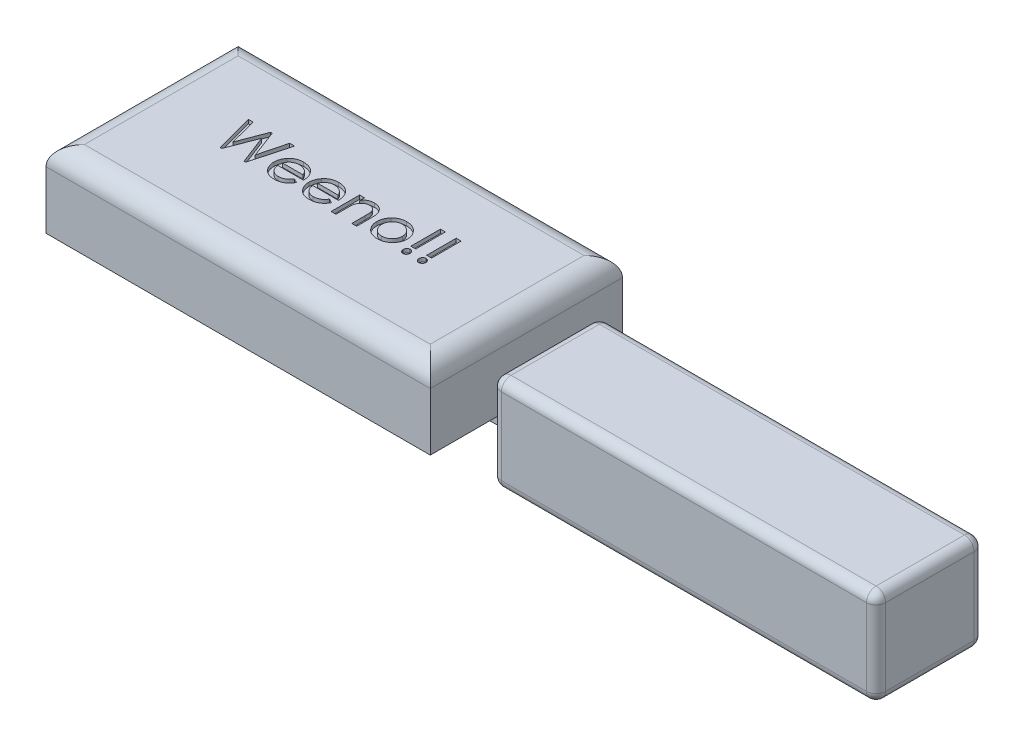
from build123d import *

# Parameters (mm, degrees)
BOSS_EXTRUDE1_DEPTH      = 20
BOSS_EXTRUDE2_DEPTH      = 1
BOSS_EXTRUDE2_DEPTH_BACK = 3.5
SKETCH1_3_W              = 5
SKETCH1_3_H              = 12
BOSS_EXTRUDE3_DEPTH      = 15
BOSS_EXTRUDE3_DEPTH_BACK = 10
SKETCH2_W                = 12
SKETCH2_H                = 3.5
BOSS_EXTRUDE4_DEPTH      = 4.5
FILLET1_R                = 2.5
SKETCH3_W                = 1.282051282
SKETCH3_H                = 7.692307692
CUT_EXTRUDE1_DEPTH       = 1
FILLET2_R                = 5


with BuildPart() as part:
    # Sketch1 → Boss-Extrude1 (new body)
    with BuildSketch(Plane(origin=(0, 0, 0), x_dir=(1, 0, 0), z_dir=(0, 1, 0))):
        Polygon((50, 25), (-50, 25), (-50, -25), (50, -25), (50, -6), (50, 6), align=None)
    extrude(amount=BOSS_EXTRUDE1_DEPTH)

    # Sketch1<3> → Boss-Extrude2 (add, two sides: drawn at the far end of the back side and taken through both)
    with BuildSketch(Plane(origin=(0, 0, 0), x_dir=(1, 0, 0), z_dir=(0, 1, 0)).offset(-BOSS_EXTRUDE2_DEPTH_BACK)):
        with Locations((52.5, 0)):
            Rectangle(SKETCH1_3_W, SKETCH1_3_H)
    extrude(amount=BOSS_EXTRUDE2_DEPTH + BOSS_EXTRUDE2_DEPTH_BACK)

    # Sketch1<4> → Boss-Extrude3 (add, two sides: drawn at the far end of the back side and taken through both)
    with BuildSketch(Plane(origin=(0, 0, 0), x_dir=(1, 0, 0), z_dir=(0, 1, 0)).offset(-BOSS_EXTRUDE3_DEPTH_BACK)):
        Polygon((55, 14), (55, 6), (55, -6), (55, -14), (155, -14), (155, 14), align=None)
    extrude(amount=BOSS_EXTRUDE3_DEPTH + BOSS_EXTRUDE3_DEPTH_BACK)

    # Sketch2 → Boss-Extrude4 (add)
    with BuildSketch(Plane.ZY.offset(-50)):
        with Locations((0, -1.75)):
            Rectangle(SKETCH2_W, SKETCH2_H)
    extrude(amount=BOSS_EXTRUDE4_DEPTH)

    # Fillet1
    fillet1_edges = [part.edges().sort_by_distance(p)[0] for p in [
        (55, 2.5, -14),
        (105, -10, -14),
        (55, -10, 0),
        (105, -10, 14),
        (55, 2.5, 14),
        (105, 15, 14),
        (55, 15, 0),
        (105, 15, -14),
        (155, -10, 0),
        (155, 2.5, 14),
        (155, 15, 0),
        (155, 2.5, -14),
    ]]
    fillet(fillet1_edges, radius=FILLET1_R)

    # Sketch3 → Cut-Extrude1 (cut)
    # profile 1 of 9: a face of its own
    with BuildSketch(Plane(origin=(0, 20, 0), x_dir=(1, 0, 0), z_dir=(0, 1, 0))):
        Polygon((-29.358974359, 7), (-28.084935897, 7), (-26.252003205, -0.145432692), (-23.537660256, 7), (-23.118990385, 7), (-20.424679487, -0.131410256), (-18.581730769, 7), (-17.307692308, 7), (-20.028044872, -3), (-20.46474359, -3), (-23.339342949, 4.455929487), (-26.231971154, -3), (-26.664663462, -3), align=None)
    # profile 2 of 9: a face of its own
    with BuildSketch(Plane(origin=(0, 20, 0), x_dir=(1, 0, 0), z_dir=(0, 1, 0))):
        with BuildLine():
            Line((-9.913862179, -0.435897436), (-8.846153846, -0.946714744))
            add(Edge.make_bspline(
                [(-8.846153846, -0.946714744), (-8.913655595, -1.069390674), (-9.045109243, -1.308291132), (-9.269417602, -1.638185295), (-9.512848911, -1.928308753), (-9.773037091, -2.181872441), (-10.053228209, -2.398816509), (-10.348379214, -2.591281744), (-10.664750233, -2.752662842), (-10.998280777, -2.890606062), (-11.353349041, -2.996758493), (-11.729517882, -3.072170711), (-12.127555992, -3.119147338), (-12.400374831, -3.125137852), (-12.540064103, -3.128205128)],
                knots=[0, 0, 0, 0, 1.110387997, 2.162381809, 3.158716456, 4.110235088, 5.03849693, 5.965639636, 6.901458115, 7.851707839, 8.825366416, 9.836184406, 10.892078622, 12, 12, 12, 12], degree=3))
            add(Edge.make_bspline(
                [(-12.540064103, -3.128205128), (-12.68783843, -3.125160716), (-12.97649493, -3.119213881), (-13.396070788, -3.060758307), (-13.791979671, -2.972299885), (-14.162787395, -2.844184271), (-14.507062703, -2.67591731), (-14.828913616, -2.475001954), (-15.124557524, -2.235193815), (-15.391171189, -1.960531122), (-15.628004547, -1.663892068), (-15.839671212, -1.35696325), (-16.012799111, -1.036665247), (-16.159023103, -0.70918015), (-16.271581613, -0.370975934), (-16.35133028, -0.023535219), (-16.401410406, 0.333878202), (-16.407283096, 0.575556252), (-16.41025641, 0.697916667)],
                knots=[0, 0, 0, 0, 1.164566152, 2.274817246, 3.333639364, 4.359360714, 5.360157823, 6.349126428, 7.344925074, 8.35392925, 9.361228562, 10.335284257, 11.289572886, 12.22779236, 13.160187688, 14.095091993, 15.035554391, 16, 16, 16, 16], degree=3))
            add(Edge.make_bspline(
                [(-16.41025641, 0.697916667), (-16.407653095, 0.812238517), (-16.402489482, 1.038993122), (-16.358448793, 1.373876333), (-16.291311127, 1.69989056), (-16.194600808, 2.015702872), (-16.069437824, 2.321869113), (-15.916761288, 2.618815133), (-15.73646701, 2.9064579), (-15.597158087, 3.086838736), (-15.526842949, 3.177884615)],
                knots=[0, 0, 0, 0, 1.021096707, 2.025320431, 3.012923591, 3.992437812, 4.971861174, 5.964497656, 6.972595394, 8, 8, 8, 8], degree=3))
            add(Edge.make_bspline(
                [(-15.526842949, 3.177884615), (-15.43175522, 3.288351878), (-15.244333721, 3.506087018), (-14.924930755, 3.78928787), (-14.58263383, 4.030247921), (-14.215187626, 4.224758102), (-13.825316476, 4.379304323), (-13.410794052, 4.486157683), (-12.97284504, 4.551719247), (-12.673177926, 4.559914403), (-12.520032051, 4.564102564)],
                knots=[0, 0, 0, 0, 1.018725525, 2.007946416, 2.977291296, 3.940674949, 4.909614547, 5.904411593, 6.929042575, 8, 8, 8, 8], degree=3))
            add(Edge.make_bspline(
                [(-12.520032051, 4.564102564), (-12.354842746, 4.560296288), (-12.032332722, 4.552865043), (-11.56314089, 4.482536821), (-11.120593514, 4.371448757), (-10.705801742, 4.21239874), (-10.317926986, 4.008443276), (-9.957072723, 3.760415125), (-9.622549946, 3.466858461), (-9.429047157, 3.239223057), (-9.330929487, 3.123798077)],
                knots=[0, 0, 0, 0, 1.092510559, 2.132980742, 3.131821249, 4.106721871, 5.065344059, 6.025034973, 6.998572742, 8, 8, 8, 8], degree=3))
            add(Edge.make_bspline(
                [(-9.330929487, 3.123798077), (-9.262230989, 3.034313907), (-9.125274172, 2.855918926), (-8.953694966, 2.56360418), (-8.804467522, 2.256605587), (-8.681535036, 1.930925837), (-8.589095391, 1.586953763), (-8.517593657, 1.227150479), (-8.476363511, 0.849747961), (-8.467867331, 0.592507438), (-8.463541667, 0.461538462)],
                knots=[0, 0, 0, 0, 0.947891001, 1.889708495, 2.844047414, 3.816063809, 4.811874475, 5.836031954, 6.898258033, 8, 8, 8, 8], degree=3))
            Line((-8.463541667, 0.461538462), (-15.130208333, 0.461538462))
            add(Edge.make_bspline(
                [(-15.130208333, 0.461538462), (-15.126769122, 0.376550556), (-15.120015293, 0.209653613), (-15.077456533, -0.034089462), (-15.018403271, -0.267904715), (-14.935649537, -0.491429312), (-14.830887993, -0.704804387), (-14.704533214, -0.907890058), (-14.554673936, -1.099143336), (-14.385529747, -1.278027846), (-14.20097812, -1.440784388), (-14.005991166, -1.583782489), (-13.802037137, -1.705985085), (-13.587841803, -1.802968014), (-13.365465145, -1.880794615), (-13.13422148, -1.933344679), (-12.894463669, -1.970028026), (-12.731179885, -1.972900071), (-12.648237179, -1.974358974)],
                knots=[0, 0, 0, 0, 1.056285998, 2.074305788, 3.068874036, 4.051103373, 5.031155672, 6.019259974, 7.018838325, 8.046424154, 9.075617995, 10.073437039, 11.048590896, 12.025474346, 12.991505956, 13.972050267, 14.969869311, 16, 16, 16, 16], degree=3))
            add(Edge.make_bspline(
                [(-12.648237179, -1.974358974), (-12.559313621, -1.972686932), (-12.382215118, -1.969356923), (-12.120018665, -1.934799368), (-11.861572658, -1.886362802), (-11.61123286, -1.812961974), (-11.370894255, -1.727044807), (-11.148063198, -1.624493048), (-10.944694789, -1.510441056), (-10.752995517, -1.378499833), (-10.562014943, -1.213075057), (-10.360812582, -1.000354155), (-10.141263639, -0.736715994), (-9.993120028, -0.540743868), (-9.913862179, -0.435897436)],
                knots=[0, 0, 0, 0, 0.974501181, 1.940798391, 2.895710587, 3.855187413, 4.797895034, 5.692306932, 6.541458453, 7.351844759, 8.239729442, 9.306468335, 10.558942083, 12, 12, 12, 12], degree=3))
        make_face()
        with BuildLine():
            add(Edge.make_bspline(
                [(-9.743589744, 1.615384615), (-9.776076827, 1.698205203), (-9.840870006, 1.863384978), (-9.965614199, 2.097875046), (-10.113317414, 2.316863156), (-10.279848064, 2.523688545), (-10.473701455, 2.713978574), (-10.698006842, 2.883804267), (-10.950291223, 3.037790083), (-11.230626953, 3.166913329), (-11.527938747, 3.274640754), (-11.836327021, 3.353588747), (-12.152657706, 3.400666276), (-12.366296465, 3.407042935), (-12.473958333, 3.41025641)],
                knots=[0, 0, 0, 0, 0.917468198, 1.829825112, 2.733739057, 3.639830069, 4.565591991, 5.528900948, 6.536885056, 7.609579627, 8.708054817, 9.795976896, 10.889296829, 12, 12, 12, 12], degree=3))
            add(Edge.make_bspline(
                [(-12.473958333, 3.41025641), (-12.55616347, 3.408182553), (-12.719046072, 3.404073379), (-12.959741995, 3.375836816), (-13.193084006, 3.327875754), (-13.418963454, 3.25921645), (-13.637211213, 3.170794544), (-13.849066476, 3.063868541), (-14.053735829, 2.938128462), (-14.182137288, 2.840451861), (-14.246794872, 2.791266026)],
                knots=[0, 0, 0, 0, 1.030056501, 2.040970785, 3.032161429, 4.011555994, 4.995123754, 5.979296403, 6.982458509, 8, 8, 8, 8], degree=3))
            add(Edge.make_bspline(
                [(-14.246794872, 2.791266026), (-14.328894744, 2.718994273), (-14.496917555, 2.571085356), (-14.705499624, 2.293448172), (-14.893140912, 1.975138534), (-14.98716973, 1.738446694), (-15.036057692, 1.615384615)],
                knots=[0, 0, 0, 0, 0.913853049, 1.870260628, 2.892694598, 4, 4, 4, 4], degree=3))
            Line((-15.036057692, 1.615384615), (-9.743589744, 1.615384615))
        make_face(mode=Mode.SUBTRACT)
    # profile 3 of 9: a face of its own
    with BuildSketch(Plane(origin=(0, 20, 0), x_dir=(1, 0, 0), z_dir=(0, 1, 0))):
        with BuildLine():
            Line((-0.811298077, -0.435897436), (0.256410256, -0.946714744))
            add(Edge.make_bspline(
                [(0.256410256, -0.946714744), (0.188908508, -1.069390674), (0.057454859, -1.308291132), (-0.166853499, -1.638185295), (-0.410284808, -1.928308753), (-0.670472988, -2.181872441), (-0.950664106, -2.398816509), (-1.245815111, -2.591281744), (-1.562186131, -2.752662842), (-1.895716674, -2.890606062), (-2.250784938, -2.996758493), (-2.62695378, -3.072170711), (-3.024991889, -3.119147338), (-3.297810728, -3.125137852), (-3.4375, -3.128205128)],
                knots=[0, 0, 0, 0, 1.110387997, 2.162381809, 3.158716456, 4.110235088, 5.03849693, 5.965639636, 6.901458115, 7.851707839, 8.825366416, 9.836184406, 10.892078622, 12, 12, 12, 12], degree=3))
            add(Edge.make_bspline(
                [(-3.4375, -3.128205128), (-3.585274328, -3.125160716), (-3.873930827, -3.119213881), (-4.293506685, -3.060758307), (-4.689415568, -2.972299885), (-5.060223292, -2.844184271), (-5.4044986, -2.67591731), (-5.726349514, -2.475001954), (-6.021993421, -2.235193815), (-6.288607086, -1.960531122), (-6.525440444, -1.663892068), (-6.73710711, -1.35696325), (-6.910235008, -1.036665247), (-7.056459, -0.70918015), (-7.169017511, -0.370975934), (-7.248766178, -0.023535219), (-7.298846303, 0.333878202), (-7.304718993, 0.575556252), (-7.307692308, 0.697916667)],
                knots=[0, 0, 0, 0, 1.164566152, 2.274817246, 3.333639364, 4.359360714, 5.360157823, 6.349126428, 7.344925074, 8.35392925, 9.361228562, 10.335284257, 11.289572886, 12.22779236, 13.160187688, 14.095091993, 15.035554391, 16, 16, 16, 16], degree=3))
            add(Edge.make_bspline(
                [(-7.307692308, 0.697916667), (-7.305088992, 0.812238517), (-7.299925379, 1.038993122), (-7.255884691, 1.373876333), (-7.188747024, 1.69989056), (-7.092036706, 2.015702872), (-6.966873721, 2.321869113), (-6.814197186, 2.618815133), (-6.633902907, 2.9064579), (-6.494593984, 3.086838736), (-6.424278846, 3.177884615)],
                knots=[0, 0, 0, 0, 1.021096707, 2.025320431, 3.012923591, 3.992437812, 4.971861174, 5.964497656, 6.972595394, 8, 8, 8, 8], degree=3))
            add(Edge.make_bspline(
                [(-6.424278846, 3.177884615), (-6.329191117, 3.288351878), (-6.141769618, 3.506087018), (-5.822366653, 3.78928787), (-5.480069728, 4.030247921), (-5.112623524, 4.224758102), (-4.722752374, 4.379304323), (-4.308229949, 4.486157683), (-3.870280937, 4.551719247), (-3.570613824, 4.559914403), (-3.417467949, 4.564102564)],
                knots=[0, 0, 0, 0, 1.018725525, 2.007946416, 2.977291296, 3.940674949, 4.909614547, 5.904411593, 6.929042575, 8, 8, 8, 8], degree=3))
            add(Edge.make_bspline(
                [(-3.417467949, 4.564102564), (-3.252278643, 4.560296288), (-2.929768619, 4.552865043), (-2.460576788, 4.482536821), (-2.018029411, 4.371448757), (-1.603237639, 4.21239874), (-1.215362884, 4.008443276), (-0.85450862, 3.760415125), (-0.519985844, 3.466858461), (-0.326483055, 3.239223057), (-0.228365385, 3.123798077)],
                knots=[0, 0, 0, 0, 1.092510559, 2.132980742, 3.131821249, 4.106721871, 5.065344059, 6.025034973, 6.998572742, 8, 8, 8, 8], degree=3))
            add(Edge.make_bspline(
                [(-0.228365385, 3.123798077), (-0.159666887, 3.034313907), (-0.022710069, 2.855918926), (0.148869137, 2.56360418), (0.29809658, 2.256605587), (0.421029067, 1.930925837), (0.513468712, 1.586953763), (0.584970445, 1.227150479), (0.626200591, 0.849747961), (0.634696772, 0.592507438), (0.639022436, 0.461538462)],
                knots=[0, 0, 0, 0, 0.947891001, 1.889708495, 2.844047414, 3.816063809, 4.811874475, 5.836031954, 6.898258033, 8, 8, 8, 8], degree=3))
            Line((0.639022436, 0.461538462), (-6.027644231, 0.461538462))
            add(Edge.make_bspline(
                [(-6.027644231, 0.461538462), (-6.02420502, 0.376550556), (-6.01745119, 0.209653613), (-5.97489243, -0.034089462), (-5.915839168, -0.267904715), (-5.833085434, -0.491429312), (-5.72832389, -0.704804387), (-5.601969111, -0.907890058), (-5.452109834, -1.099143336), (-5.282965644, -1.278027846), (-5.098414017, -1.440784388), (-4.903427063, -1.583782489), (-4.699473035, -1.705985085), (-4.485277701, -1.802968014), (-4.262901043, -1.880794615), (-4.031657378, -1.933344679), (-3.791899567, -1.970028026), (-3.628615782, -1.972900071), (-3.545673077, -1.974358974)],
                knots=[0, 0, 0, 0, 1.056285998, 2.074305788, 3.068874036, 4.051103373, 5.031155672, 6.019259974, 7.018838325, 8.046424154, 9.075617995, 10.073437039, 11.048590896, 12.025474346, 12.991505956, 13.972050267, 14.969869311, 16, 16, 16, 16], degree=3))
            add(Edge.make_bspline(
                [(-3.545673077, -1.974358974), (-3.456749518, -1.972686932), (-3.279651015, -1.969356923), (-3.017454563, -1.934799368), (-2.759008555, -1.886362802), (-2.508668758, -1.812961974), (-2.268330152, -1.727044807), (-2.045499095, -1.624493048), (-1.842130687, -1.510441056), (-1.650431414, -1.378499833), (-1.459450841, -1.213075057), (-1.25824848, -1.000354155), (-1.038699536, -0.736715994), (-0.890555925, -0.540743868), (-0.811298077, -0.435897436)],
                knots=[0, 0, 0, 0, 0.974501181, 1.940798391, 2.895710587, 3.855187413, 4.797895034, 5.692306932, 6.541458453, 7.351844759, 8.239729442, 9.306468335, 10.558942083, 12, 12, 12, 12], degree=3))
        make_face()
        with BuildLine():
            add(Edge.make_bspline(
                [(-0.641025641, 1.615384615), (-0.673512725, 1.698205203), (-0.738305904, 1.863384978), (-0.863050097, 2.097875046), (-1.010753312, 2.316863156), (-1.177283961, 2.523688545), (-1.371137352, 2.713978574), (-1.59544274, 2.883804267), (-1.84772712, 3.037790083), (-2.128062851, 3.166913329), (-2.425374645, 3.274640754), (-2.733762918, 3.353588747), (-3.050093604, 3.400666276), (-3.263732362, 3.407042935), (-3.371394231, 3.41025641)],
                knots=[0, 0, 0, 0, 0.917468198, 1.829825112, 2.733739057, 3.639830069, 4.565591991, 5.528900948, 6.536885056, 7.609579627, 8.708054817, 9.795976896, 10.889296829, 12, 12, 12, 12], degree=3))
            add(Edge.make_bspline(
                [(-3.371394231, 3.41025641), (-3.453599368, 3.408182553), (-3.61648197, 3.404073379), (-3.857177892, 3.375836816), (-4.090519903, 3.327875754), (-4.316399351, 3.25921645), (-4.53464711, 3.170794544), (-4.746502373, 3.063868541), (-4.951171727, 2.938128462), (-5.079573186, 2.840451861), (-5.144230769, 2.791266026)],
                knots=[0, 0, 0, 0, 1.030056501, 2.040970785, 3.032161429, 4.011555994, 4.995123754, 5.979296403, 6.982458509, 8, 8, 8, 8], degree=3))
            add(Edge.make_bspline(
                [(-5.144230769, 2.791266026), (-5.226330641, 2.718994273), (-5.394353453, 2.571085356), (-5.602935522, 2.293448172), (-5.790576809, 1.975138534), (-5.884605627, 1.738446694), (-5.93349359, 1.615384615)],
                knots=[0, 0, 0, 0, 0.913853049, 1.870260628, 2.892694598, 4, 4, 4, 4], degree=3))
            Line((-5.93349359, 1.615384615), (-0.641025641, 1.615384615))
        make_face(mode=Mode.SUBTRACT)
    # profile 4 of 9: a face of its own
    with BuildSketch(Plane(origin=(0, 20, 0), x_dir=(1, 0, 0), z_dir=(0, 1, 0))):
        with BuildLine():
            Line((2.179487179, 4.435897436), (3.461538462, 4.435897436))
            Line((3.461538462, 4.435897436), (3.461538462, 3.141826923))
            add(Edge.make_bspline(
                [(3.461538462, 3.141826923), (3.481176131, 3.199657563), (3.520033447, 3.314087816), (3.596334429, 3.477098176), (3.689480069, 3.628631072), (3.797798723, 3.768783877), (3.920791677, 3.898276802), (4.059990047, 4.015023831), (4.215352332, 4.11870402), (4.440016052, 4.244059424), (4.742160321, 4.37073806), (5.120691609, 4.483697092), (5.516379538, 4.551937926), (5.784989975, 4.560004059), (5.921474359, 4.564102564)],
                knots=[0, 0, 0, 0, 0.721725204, 1.428087222, 2.122703896, 2.820677415, 3.518695583, 4.230332313, 4.96387863, 5.723801269, 7.269448623, 8.825705575, 10.387100582, 12, 12, 12, 12], degree=3))
            add(Edge.make_bspline(
                [(5.921474359, 4.564102564), (5.996333508, 4.563373505), (6.144390441, 4.561931568), (6.362907215, 4.537594874), (6.575681539, 4.505780749), (6.779901867, 4.454037663), (6.978771676, 4.392650967), (7.169486739, 4.31372855), (7.355669153, 4.224617001), (7.53061743, 4.117007668), (7.698435663, 4.002124992), (7.854989263, 3.877523965), (8.000374083, 3.745087988), (8.131847887, 3.603284318), (8.251397992, 3.453095693), (8.359274336, 3.296176165), (8.453903508, 3.129493968), (8.539617457, 2.95429159), (8.612057691, 2.761577392), (8.676905518, 2.549208765), (8.72671783, 2.312185891), (8.771347913, 2.053737906), (8.804995297, 1.772230342), (8.827746536, 1.467430404), (8.845208013, 1.139488145), (8.845831937, 0.912953068), (8.846153846, 0.796073718)],
                knots=[0, 0, 0, 0, 0.988922562, 1.955897754, 2.903462704, 3.830413303, 4.737655562, 5.652253036, 6.556226254, 7.462953132, 8.363948131, 9.243414842, 10.105524893, 10.96114924, 11.796501801, 12.641129127, 13.475361786, 14.328067462, 15.216523844, 16.193837025, 17.260347067, 18.415405116, 19.660191975, 21.00599444, 22.455261645, 24, 24, 24, 24], degree=3))
            Line((8.846153846, 0.796073718), (8.846153846, -3))
            Line((8.846153846, -3), (7.564102564, -3))
            Line((7.564102564, -3), (7.564102564, 0.499599359))
            add(Edge.make_bspline(
                [(7.564102564, 0.499599359), (7.563521272, 0.595084158), (7.56240742, 0.778049101), (7.559451183, 1.039869703), (7.550275406, 1.276863686), (7.542651977, 1.488819463), (7.524560913, 1.675543435), (7.510026517, 1.838097402), (7.491364139, 1.976159354), (7.472465341, 2.058858121), (7.463942308, 2.096153846)],
                knots=[0, 0, 0, 0, 1.430152756, 2.740413335, 3.921188358, 4.982454356, 5.915965761, 6.729973834, 7.427239984, 8, 8, 8, 8], degree=3))
            add(Edge.make_bspline(
                [(7.463942308, 2.096153846), (7.436400804, 2.200692593), (7.383636324, 2.400969703), (7.256777404, 2.674057819), (7.091520848, 2.903154434), (6.892387336, 3.091541777), (6.656524466, 3.235643029), (6.386973924, 3.337798003), (6.083925376, 3.400536788), (5.870377416, 3.406928958), (5.759214744, 3.41025641)],
                knots=[0, 0, 0, 0, 1.0975214, 2.10265016, 3.040914952, 3.953360464, 4.870791917, 5.831382138, 6.871123111, 8, 8, 8, 8], degree=3))
            add(Edge.make_bspline(
                [(5.759214744, 3.41025641), (5.699024232, 3.408804759), (5.579494689, 3.405921993), (5.402140331, 3.379998815), (5.228100261, 3.343355694), (5.05801602, 3.288016489), (4.891303582, 3.217420972), (4.7271282, 3.132044154), (4.568512301, 3.027903757), (4.413409326, 2.912946574), (4.264685783, 2.786357515), (4.131823452, 2.644074446), (4.005606769, 2.497648406), (3.898205336, 2.336552116), (3.799368077, 2.169537638), (3.714817767, 1.991035112), (3.642739248, 1.803408319), (3.60485171, 1.673108814), (3.585737179, 1.607371795)],
                knots=[0, 0, 0, 0, 0.951460867, 1.889461998, 2.829957029, 3.761813917, 4.713157544, 5.691039254, 6.68414425, 7.710717288, 8.74400498, 9.767367674, 10.786963074, 11.797603157, 12.824665026, 13.854492557, 14.917576362, 16, 16, 16, 16], degree=3))
            add(Edge.make_bspline(
                [(3.585737179, 1.607371795), (3.574957794, 1.562106955), (3.55119651, 1.462328474), (3.530609849, 1.296385909), (3.506521179, 1.103056514), (3.492994608, 0.880932765), (3.477961676, 0.630621049), (3.468642803, 0.35208552), (3.462530528, 0.045568371), (3.461878638, -0.1681319), (3.461538462, -0.279647436)],
                knots=[0, 0, 0, 0, 0.589044374, 1.298446081, 2.115829079, 3.057219828, 4.116258555, 5.292827855, 6.587312255, 8, 8, 8, 8], degree=3))
            Line((3.461538462, -0.279647436), (3.461538462, -3))
            Line((3.461538462, -3), (2.179487179, -3))
            Line((2.179487179, -3), (2.179487179, 4.435897436))
        make_face()
    # profile 5 of 9: a face of its own
    with BuildSketch(Plane(origin=(0, 20, 0), x_dir=(1, 0, 0), z_dir=(0, 1, 0))):
        with BuildLine():
            add(Edge.make_bspline(
                [(14.298878205, 4.564102564), (14.447278042, 4.560038653), (14.737816914, 4.552082283), (15.162951885, 4.496105451), (15.56666072, 4.398847595), (15.950100477, 4.265732479), (16.311693108, 4.091333108), (16.65234175, 3.880339986), (16.97082849, 3.628650443), (17.162672989, 3.435661652), (17.259615385, 3.338141026)],
                knots=[0, 0, 0, 0, 1.078775739, 2.112039281, 3.110494877, 4.093081892, 5.057110616, 6.022958758, 7.000966324, 8, 8, 8, 8], degree=3))
            add(Edge.make_bspline(
                [(17.259615385, 3.338141026), (17.345583561, 3.241480816), (17.5146037, 3.051439308), (17.732996023, 2.744893334), (17.918983876, 2.429552683), (18.069453041, 2.103040001), (18.189387837, 1.766848364), (18.272563487, 1.419649366), (18.324941227, 1.062099841), (18.330513292, 0.820294932), (18.333333333, 0.697916667)],
                knots=[0, 0, 0, 0, 1.062178036, 2.088324843, 3.086640365, 4.066023852, 5.037709567, 6.014384934, 6.995073642, 8, 8, 8, 8], degree=3))
            add(Edge.make_bspline(
                [(18.333333333, 0.697916667), (18.329808692, 0.574863129), (18.322823342, 0.330988122), (18.268752722, -0.029267253), (18.183239051, -0.379926844), (18.060225293, -0.719389783), (17.901909463, -1.048024398), (17.71197872, -1.36782975), (17.482983203, -1.674549312), (17.225512056, -1.969072391), (16.939388705, -2.240782559), (16.627133271, -2.478662217), (16.292573753, -2.679971721), (15.936314257, -2.845677223), (15.556655733, -2.970889888), (15.157276017, -3.063617692), (14.735093905, -3.118379446), (14.446609194, -3.124877514), (14.298878205, -3.128205128)],
                knots=[0, 0, 0, 0, 0.952871876, 1.888459614, 2.815544184, 3.744891397, 4.679563604, 5.637601804, 6.621431805, 7.640342292, 8.664856555, 9.672479278, 10.67487095, 11.683873433, 12.709444777, 13.765907845, 14.855937143, 16, 16, 16, 16], degree=3))
            add(Edge.make_bspline(
                [(14.298878205, -3.128205128), (14.157788547, -3.124964579), (13.88121197, -3.118612164), (13.477049001, -3.062216605), (13.09164985, -2.976150619), (12.727825119, -2.848109619), (12.382577643, -2.68799183), (12.058216966, -2.489397551), (11.752244732, -2.257051495), (11.472642536, -1.98822595), (11.217793239, -1.699228845), (10.996588125, -1.392420069), (10.806330883, -1.074932638), (10.651654485, -0.744081068), (10.533123738, -0.399984314), (10.446336401, -0.045482009), (10.395656169, 0.322526622), (10.388331688, 0.571561221), (10.384615385, 0.697916667)],
                knots=[0, 0, 0, 0, 1.108842573, 2.173652473, 3.202745058, 4.208988794, 5.200203338, 6.189803525, 7.193715926, 8.215010613, 9.234454675, 10.219573757, 11.184848795, 12.140854958, 13.08565054, 14.042002664, 15.006549187, 16, 16, 16, 16], degree=3))
            add(Edge.make_bspline(
                [(10.384615385, 0.697916667), (10.387642135, 0.822929758), (10.393605433, 1.069230285), (10.442488579, 1.432394177), (10.525428138, 1.781341496), (10.637236564, 2.118896234), (10.784878928, 2.442488194), (10.964374025, 2.753943308), (11.174098659, 3.054411534), (11.337582017, 3.238844574), (11.420272436, 3.33213141)],
                knots=[0, 0, 0, 0, 1.034079547, 2.037341334, 3.024980457, 3.998111168, 4.974764182, 5.962233312, 6.969290918, 8, 8, 8, 8], degree=3))
            add(Edge.make_bspline(
                [(11.420272436, 3.33213141), (11.516469657, 3.43039919), (11.70611695, 3.624128468), (12.021782575, 3.875298152), (12.354826199, 4.089453852), (12.708598462, 4.261658021), (13.078970613, 4.400019465), (13.469581694, 4.495377587), (13.878538908, 4.552066083), (14.157136941, 4.560043781), (14.298878205, 4.564102564)],
                knots=[0, 0, 0, 0, 1.021997278, 2.014808882, 2.992991082, 3.961403697, 4.935644248, 5.92819495, 6.945935601, 8, 8, 8, 8], degree=3))
        make_face()
        with BuildLine():
            add(Edge.make_bspline(
                [(14.294871795, 3.41025641), (14.209273687, 3.407975478), (14.039314075, 3.403446566), (13.788977482, 3.366386828), (13.545661407, 3.306457822), (13.312035843, 3.219451091), (13.084574426, 3.110718937), (12.867099896, 2.975288566), (12.654710979, 2.818656318), (12.455139648, 2.637280392), (12.269458441, 2.439826196), (12.10858069, 2.225693694), (11.970954272, 2.000886692), (11.860735638, 1.762567562), (11.773650013, 1.512354104), (11.7127149, 1.249765555), (11.672552264, 0.974925484), (11.66865542, 0.787539444), (11.666666667, 0.691907051)],
                knots=[0, 0, 0, 0, 0.976916649, 1.939720157, 2.882730922, 3.833047911, 4.780976627, 5.756404754, 6.753607, 7.790049989, 8.831165002, 9.84360893, 10.842529111, 11.835057585, 12.835634664, 13.861933882, 14.908838789, 16, 16, 16, 16], degree=3))
            add(Edge.make_bspline(
                [(11.666666667, 0.691907051), (11.671220165, 0.56735522), (11.680181572, 0.322233907), (11.753409224, -0.036806543), (11.869625424, -0.379941712), (12.031887328, -0.702694225), (12.230247493, -0.997975186), (12.461467241, -1.256477545), (12.716705701, -1.480259007), (13.000890587, -1.659964017), (13.304278301, -1.800617343), (13.622762706, -1.900749477), (13.954547912, -1.96333014), (14.180412408, -1.970649703), (14.294871795, -1.974358974)],
                knots=[0, 0, 0, 0, 1.073737222, 2.11314337, 3.147909503, 4.191315005, 5.220292011, 6.207728104, 7.175628903, 8.139268678, 9.098074859, 10.052770626, 11.013219503, 12, 12, 12, 12], degree=3))
            add(Edge.make_bspline(
                [(14.294871795, -1.974358974), (14.41868981, -1.970128415), (14.662679755, -1.961791875), (15.020036553, -1.895534093), (15.361311507, -1.789149602), (15.684113265, -1.640880674), (15.983690182, -1.453044218), (16.251574841, -1.225075508), (16.486352695, -0.960753891), (16.687381737, -0.666126566), (16.849721298, -0.346454399), (16.966272335, -0.010959323), (17.036966834, 0.337071343), (17.046473868, 0.572725133), (17.051282051, 0.691907051)],
                knots=[0, 0, 0, 0, 1.042880454, 2.055051067, 3.051726387, 4.048830532, 5.040201766, 6.022282375, 7.002717173, 8.011000956, 9.020163719, 10.014978664, 10.996075346, 12, 12, 12, 12], degree=3))
            add(Edge.make_bspline(
                [(17.051282051, 0.691907051), (17.04919284, 0.784190432), (17.045071591, 0.966231761), (17.005736391, 1.234064882), (16.941896118, 1.491966046), (16.851177821, 1.738783401), (16.736296918, 1.975375544), (16.594950119, 2.200733868), (16.427638198, 2.415932582), (16.236906252, 2.61748875), (16.03015129, 2.802810652), (15.811687812, 2.966471396), (15.581964152, 3.102397423), (15.344164314, 3.216943604), (15.0949339, 3.302061551), (14.836834251, 3.364420167), (14.569206169, 3.404127656), (14.387158427, 3.408194685), (14.294871795, 3.41025641)],
                knots=[0, 0, 0, 0, 1.02928639, 2.030405262, 3.013559112, 3.98951401, 4.959304921, 5.943474834, 6.952548865, 7.996299005, 9.035918103, 10.047849461, 11.03697177, 12.01024899, 12.98822153, 13.969594738, 14.97071361, 16, 16, 16, 16], degree=3))
        make_face(mode=Mode.SUBTRACT)
    # profile 6 of 9: a face of its own
    with BuildSketch(Plane(origin=(0, 20, 0), x_dir=(1, 0, 0), z_dir=(0, 1, 0))):
        with Locations((21.025641026, 3.41025641)):
            Rectangle(SKETCH3_W, SKETCH3_H)
    # profile 7 of 9: a face of its own
    with BuildSketch(Plane(origin=(0, 20, 0), x_dir=(1, 0, 0), z_dir=(0, 1, 0))):
        with BuildLine():
            add(Edge.make_bspline(
                [(20.961538462, -1.205128205), (21.032132988, -1.207907646), (21.168624048, -1.213281558), (21.360509242, -1.27417717), (21.530273204, -1.369417583), (21.668636051, -1.503547705), (21.779192017, -1.656917524), (21.86338427, -1.819706944), (21.913800208, -1.991441231), (21.919984617, -2.108256913), (21.923076923, -2.166666667)],
                knots=[0, 0, 0, 0, 1.116361404, 2.158430099, 3.159638871, 4.178787798, 5.187366709, 6.149072616, 7.074505995, 8, 8, 8, 8], degree=3))
            add(Edge.make_bspline(
                [(21.923076923, -2.166666667), (21.920040258, -2.224437405), (21.91396591, -2.339998238), (21.862574602, -2.509666761), (21.781081868, -2.673165706), (21.671277813, -2.827757976), (21.53160502, -2.961328005), (21.363538395, -3.060276145), (21.169391197, -3.116958405), (21.032691474, -3.124355103), (20.961538462, -3.128205128)],
                knots=[0, 0, 0, 0, 0.915305536, 1.830917759, 2.788262518, 3.80582746, 4.825377036, 5.832291201, 6.871694789, 8, 8, 8, 8], degree=3))
            add(Edge.make_bspline(
                [(20.961538462, -3.128205128), (20.904315749, -3.124936392), (20.791834702, -3.118511132), (20.632048697, -3.06151839), (20.487702307, -2.97002282), (20.361157591, -2.846395588), (20.258425326, -2.697379056), (20.183401827, -2.531803197), (20.134771169, -2.353713204), (20.130419685, -2.229752661), (20.128205128, -2.166666667)],
                knots=[0, 0, 0, 0, 0.96947272, 1.905664781, 2.843435755, 3.854097926, 4.889221479, 5.899247012, 6.930884871, 8, 8, 8, 8], degree=3))
            add(Edge.make_bspline(
                [(20.128205128, -2.166666667), (20.131485702, -2.102998478), (20.1378876, -1.978752756), (20.182242924, -1.798704192), (20.260532555, -1.634800264), (20.36358347, -1.486565745), (20.490566196, -1.363034922), (20.634202869, -1.269965618), (20.794198179, -1.215381581), (20.905042902, -1.208589836), (20.961538462, -1.205128205)],
                knots=[0, 0, 0, 0, 1.082019011, 2.111513394, 3.126960972, 4.153448061, 5.164764557, 6.118798126, 7.04118529, 8, 8, 8, 8], degree=3))
        make_face()
    # profile 8 of 9: a face of its own
    with BuildSketch(Plane(origin=(0, 20, 0), x_dir=(1, 0, 0), z_dir=(0, 1, 0))):
        with Locations((25.128205128, 3.41025641)):
            Rectangle(SKETCH3_W, SKETCH3_H)
    # profile 9 of 9: a face of its own
    with BuildSketch(Plane(origin=(0, 20, 0), x_dir=(1, 0, 0), z_dir=(0, 1, 0))):
        with BuildLine():
            add(Edge.make_bspline(
                [(25.064102564, -1.205128205), (25.134697091, -1.207907646), (25.27118815, -1.213281558), (25.463073344, -1.27417717), (25.632837307, -1.369417583), (25.771200153, -1.503547705), (25.88175612, -1.656917524), (25.965948373, -1.819706944), (26.016364311, -1.991441231), (26.02254872, -2.108256913), (26.025641026, -2.166666667)],
                knots=[0, 0, 0, 0, 1.116361404, 2.158430099, 3.159638871, 4.178787798, 5.187366709, 6.149072616, 7.074505995, 8, 8, 8, 8], degree=3))
            add(Edge.make_bspline(
                [(26.025641026, -2.166666667), (26.02260436, -2.224437405), (26.016530012, -2.339998238), (25.965138705, -2.509666761), (25.88364597, -2.673165706), (25.773841916, -2.827757976), (25.634169123, -2.961328005), (25.466102498, -3.060276145), (25.2719553, -3.116958405), (25.135255576, -3.124355103), (25.064102564, -3.128205128)],
                knots=[0, 0, 0, 0, 0.915305536, 1.830917759, 2.788262518, 3.80582746, 4.825377036, 5.832291201, 6.871694789, 8, 8, 8, 8], degree=3))
            add(Edge.make_bspline(
                [(25.064102564, -3.128205128), (25.006879852, -3.124936392), (24.894398805, -3.118511132), (24.734612799, -3.06151839), (24.590266409, -2.97002282), (24.463721693, -2.846395588), (24.360989429, -2.697379056), (24.28596593, -2.531803197), (24.237335272, -2.353713204), (24.232983788, -2.229752661), (24.230769231, -2.166666667)],
                knots=[0, 0, 0, 0, 0.96947272, 1.905664781, 2.843435755, 3.854097926, 4.889221479, 5.899247012, 6.930884871, 8, 8, 8, 8], degree=3))
            add(Edge.make_bspline(
                [(24.230769231, -2.166666667), (24.234049805, -2.102998478), (24.240451703, -1.978752756), (24.284807026, -1.798704192), (24.363096657, -1.634800264), (24.466147572, -1.486565745), (24.593130298, -1.363034922), (24.736766972, -1.269965618), (24.896762281, -1.215381581), (25.007607005, -1.208589836), (25.064102564, -1.205128205)],
                knots=[0, 0, 0, 0, 1.082019011, 2.111513394, 3.126960972, 4.153448061, 5.164764557, 6.118798126, 7.04118529, 8, 8, 8, 8], degree=3))
        make_face()
    extrude(amount=-CUT_EXTRUDE1_DEPTH, mode=Mode.SUBTRACT)

    # Fillet2
    fillet2_edges = [part.edges().sort_by_distance(p)[0] for p in [
        (0, 20, 25),
        (50, 20, 0),
        (0, 20, -25),
        (-50, 20, 0),
    ]]
    fillet(fillet2_edges, radius=FILLET2_R)


solid = part.part
